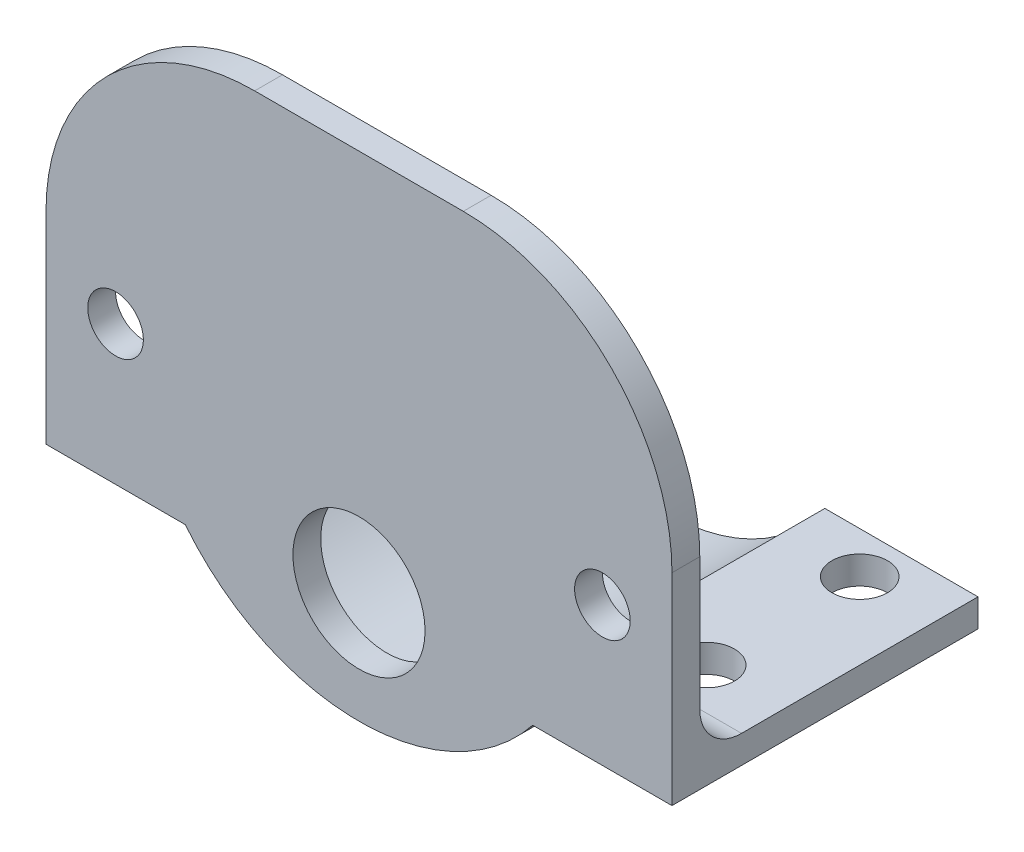
from build123d import *

# Parameters (mm, degrees)
SKETCH1_R           = 2
BOSS_EXTRUDE2_DEPTH = 2
BOSS_EXTRUDE3_START = -22
BOSS_EXTRUDE3_DEPTH = 22
FILLET1_R           = 15
FILLET2_R           = 3
SKETCH3_R           = 2
CUT_EXTRUDE1_DEPTH  = 21


with BuildPart() as part:
    # Sketch1 → Boss-Extrude2 (new body)
    # profile 1 of 5: a face of its own
    with BuildSketch(Plane.XY):
        with BuildLine():
            Line((-22.5, 19.5), (-22.5, -8))
            Line((-22.5, -8), (-11.489125293, -8))
            ThreePointArc((-11.489125293, -8), (-4.192388692, 13.357540082), (14, 0))
            ThreePointArc((14, 0), (13.357540082, -4.192388692), (11.489125293, -8))
            Line((11.489125293, -8), (22.5, -8))
            Line((22.5, -8), (22.5, 19.5))
            Line((22.5, 19.5), (-22.5, 19.5))
        make_face()
        with Locations((-17.5, 0)):
            Circle(SKETCH1_R, mode=Mode.SUBTRACT)
        with Locations((17.5, 0)):
            Circle(SKETCH1_R, mode=Mode.SUBTRACT)
    # profile 2 of 5: a face of its own
    with BuildSketch(Plane.XY):
        with BuildLine():
            ThreePointArc((14, 0), (-4.192388692, 13.357540082), (-11.489125293, -8))
            Line((-11.489125293, -8), (-4.75, -8))
            ThreePointArc((-4.75, -8), (0, -3.25), (4.75, -8))
            Line((4.75, -8), (11.489125293, -8))
            ThreePointArc((11.489125293, -8), (13.357540082, -4.192388692), (14, 0))
        make_face()
    # profile 3 of 5: a face of its own
    with BuildSketch(Plane.XY):
        with BuildLine():
            Line((-4.75, -8), (-11.489125293, -8))
            ThreePointArc((-11.489125293, -8), (0, -14), (11.489125293, -8))
            Line((11.489125293, -8), (4.75, -8))
            ThreePointArc((4.75, -8), (0, -12.75), (-4.75, -8))
        make_face()
    # profile 4 of 5: a face of its own
    with BuildSketch(Plane.XY):
        with BuildLine():
            ThreePointArc((14, 0), (-4.192388692, 13.357540082), (-11.489125293, -8))
            Line((-11.489125293, -8), (-4.75, -8))
            ThreePointArc((-4.75, -8), (0, -3.25), (4.75, -8))
            Line((4.75, -8), (11.489125293, -8))
            ThreePointArc((11.489125293, -8), (13.357540082, -4.192388692), (14, 0))
        make_face()
    # profile 5 of 5: a face of its own
    with BuildSketch(Plane.XY):
        with BuildLine():
            Line((-4.75, -8), (-11.489125293, -8))
            ThreePointArc((-11.489125293, -8), (0, -14), (11.489125293, -8))
            Line((11.489125293, -8), (4.75, -8))
            ThreePointArc((4.75, -8), (0, -12.75), (-4.75, -8))
        make_face()
    extrude(amount=BOSS_EXTRUDE2_DEPTH)

    # Sketch2 → Boss-Extrude3 (add)
    with BuildSketch(Plane.XY.offset(2).offset(BOSS_EXTRUDE3_START)):
        with BuildLine():
            Line((-22.5, -8), (-22.5, -10))
            Line((-22.5, -10), (-12.489995997, -10))
            ThreePointArc((-12.489995997, -10), (0, -16), (12.489995997, -10))
            Line((12.489995997, -10), (22.5, -10))
            Line((22.5, -10), (22.5, -8))
            Line((22.5, -8), (11.489125293, -8))
            ThreePointArc((11.489125293, -8), (0, -14), (-11.489125293, -8))
            Line((-11.489125293, -8), (-22.5, -8))
        make_face()
    extrude(amount=BOSS_EXTRUDE3_DEPTH)

    # Fillet1
    fillet1_edges = [part.edges().sort_by_distance(p)[0] for p in [
        (-22.5, 19.5, 1),
        (22.5, 19.5, 1),
    ]]
    fillet(fillet1_edges, radius=FILLET1_R)

    # Fillet2
    fillet2_edges = [part.edges().sort_by_distance(p)[0] for p in [
        (-16.994562647, -8, 0),
        (16.994562647, -8, 0),
    ]]
    fillet(fillet2_edges, radius=FILLET2_R)

    # Sketch3 → Cut-Extrude1 (cut)
    with BuildSketch(Plane(origin=(0, -8, 0), x_dir=(1, 0, 0), z_dir=(0, 1, 0))):
        with Locations(Location((-16.994562647, 6, 0), (0, 0, 270))):
            Circle(SKETCH3_R)
        with Locations(Location((-16.994562647, 17, 0), (0, 0, 270))):
            Circle(SKETCH3_R)
        with Locations(Location((16.994562647, 17, 0), (0, 0, 270))):
            Circle(SKETCH3_R)
        with Locations(Location((16.994562647, 6, 0), (0, 0, 270))):
            Circle(SKETCH3_R)
    extrude(amount=-CUT_EXTRUDE1_DEPTH, mode=Mode.SUBTRACT)


solid = part.part
